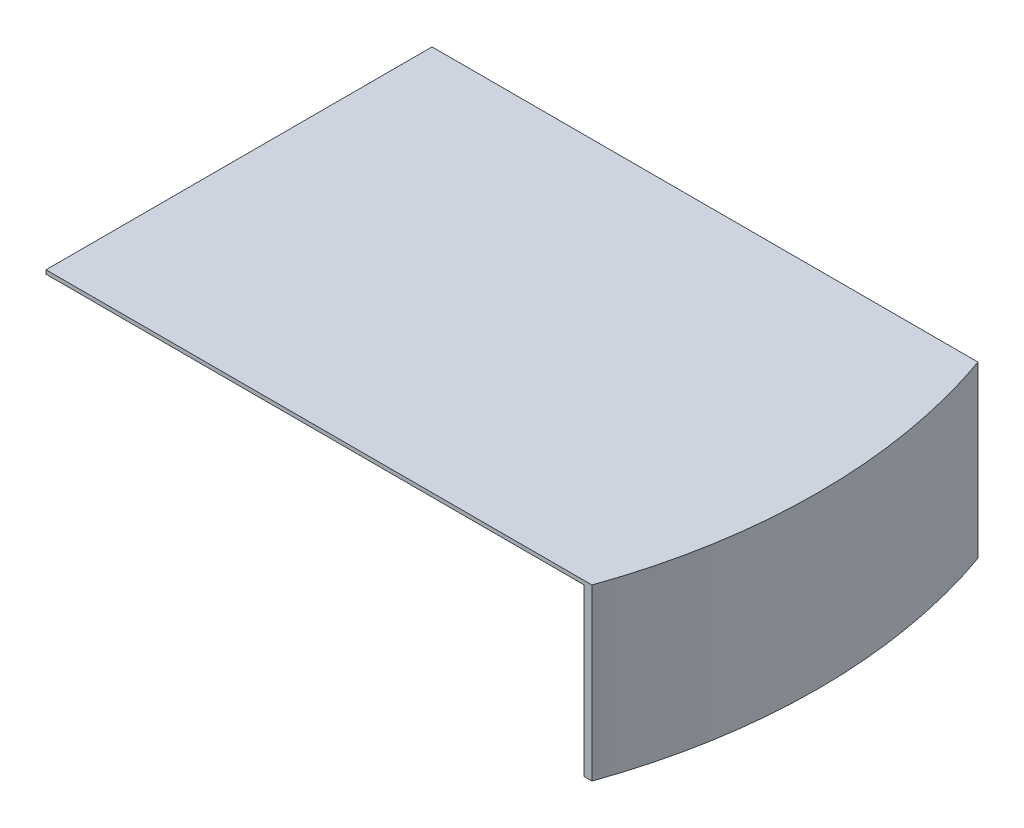
from build123d import *

# Parameters (mm, degrees)
BOSS_EXTRUDE1_DEPTH = 44
SHELL1_T            = -2
CUT_EXTRUDE1_DEPTH  = 1


with BuildPart() as part:
    # Sketch1 → Boss-Extrude1 (new body)
    with BuildSketch(Plane(origin=(0, 0, 0), x_dir=(1, 0, 0), z_dir=(0, 1, 0))):
        with BuildLine():
            Line((0, 0), (0, 50))
            Line((0, 50), (141.421356237, 50))
            ThreePointArc((141.421356237, 50), (150, 0), (141.421356237, -50))
            Line((141.421356237, -50), (0, -50))
            Line((0, -50), (0, 0))
        make_face()
    extrude(amount=BOSS_EXTRUDE1_DEPTH)

    # Shell1
    shell1_openings = [part.faces().sort_by_distance(p)[0] for p in [
        (70.710678119, 22, 50),
        (73.609024715, 0, 0),
        (0, 22, 0),
        (70.710678119, 22, -50),
    ]]
    offset(amount=SHELL1_T, openings=shell1_openings, kind=Kind.INTERSECTION)

    # Sketch3 → Cut-Extrude1 (cut)
    with BuildSketch(Plane.XZ.offset(-42)):
        with BuildLine():
            Line((0, 30), (144.927568116, 30))
            ThreePointArc((144.927568116, 30), (142.464303142, 40.098906848), (139.298241195, 50))
            Line((139.298241195, 50), (0, 50))
            Line((0, 50), (0, 30))
        make_face()
    extrude(amount=-CUT_EXTRUDE1_DEPTH, mode=Mode.SUBTRACT)


solid = part.part
